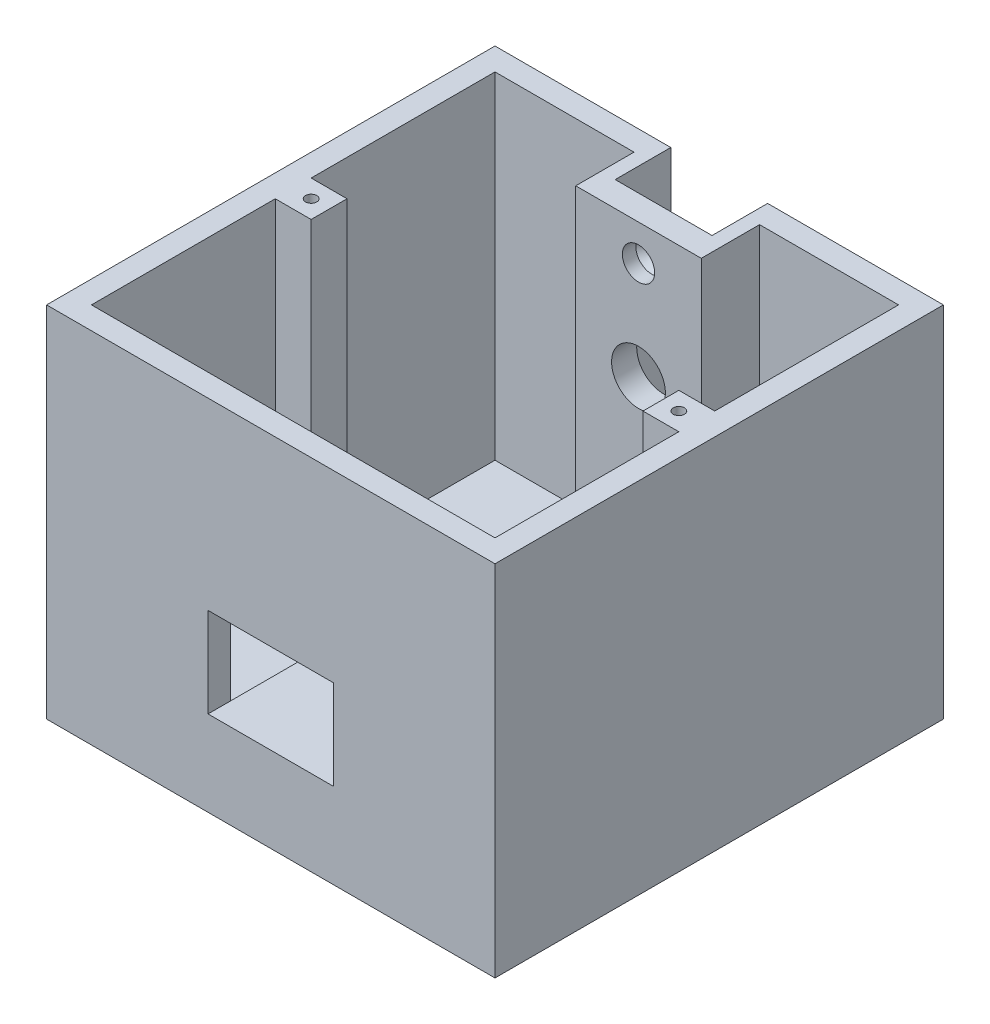
from build123d import *

# Parameters (mm, degrees)
SKETCH1_W                                      = 50
SKETCH1_H                                      = 50
BOSS_EXTRUDE1_DEPTH                            = 40
SHELL1_T                                       = -2.5
SKETCH2_W                                      = 14
SKETCH2_H                                      = 45
BOSS_EXTRUDE2_DEPTH                            = 7
SKETCH4_W                                      = 10.8
SKETCH4_H                                      = 30.2
CUT_EXTRUDE1_DEPTH                             = 6.2
CSK_SLOT_FOR_M1_6_COUNTERSUNK_FLAT_H_2_COUNT   = 2
CSK_SLOT_FOR_M1_6_COUNTERSUNK_FLAT_H_2_PITCH   = 22
CUT_EXTRUDE4_REACH                             = 48.693
SKETCH11_W                                     = 14
SKETCH11_H                                     = 12
SKETCH19_W                                     = 14
SKETCH19_H                                     = 30.5
BOSS_EXTRUDE5_DEPTH                            = 6.5
SKETCH20_W                                     = 10.8
SKETCH20_H                                     = 30.2
CUT_EXTRUDE6_DEPTH                             = 6.2
CSK_SLOT_FOR_M1_6_COUNTERSUNK_FLAT_H_3_A_COUNT = 2
CSK_SLOT_FOR_M1_6_COUNTERSUNK_FLAT_H_3_A_PITCH = 22
SKETCH30_W                                     = 4
SKETCH30_H                                     = 4
BOSS_EXTRUDE6_DEPTH                            = 37.5
CUT_EXTRUDE8_REACH                             = 66.37
SKETCH33_R                                     = 3
SKETCH35_W                                     = 14
SKETCH35_H                                     = 10
CUT_EXTRUDE10_DEPTH                            = 10


with BuildPart() as part:
    # Sketch1 → Boss-Extrude1 (new body)
    with BuildSketch(Plane(origin=(0, 0, 0), x_dir=(1, 0, 0), z_dir=(0, 1, 0))):
        Rectangle(SKETCH1_W, SKETCH1_H)
    extrude(amount=BOSS_EXTRUDE1_DEPTH)

    # Shell1
    shell1_openings = [part.faces().sort_by_distance(p)[0] for p in [
        (0, 40, 0),
    ]]
    offset(amount=SHELL1_T, openings=shell1_openings, kind=Kind.INTERSECTION)

    # Sketch2 → Boss-Extrude2 (add)
    with BuildSketch(Plane(origin=(0, 2.5, 0), x_dir=(1, 0, 0), z_dir=(0, 1, 0))):
        Rectangle(SKETCH2_W, SKETCH2_H)
    extrude(amount=BOSS_EXTRUDE2_DEPTH)

    # Sketch4 → Cut-Extrude1 (cut)
    with BuildSketch(Plane.XZ):
        Rectangle(SKETCH4_W, SKETCH4_H)
    extrude(amount=-CUT_EXTRUDE1_DEPTH, mode=Mode.SUBTRACT)

    # Sketch7 → CSK SLOT for M1.6 Countersunk Flat Head (revolve, cut)
    with BuildSketch(Plane(origin=(0, 9.5, -11), x_dir=(0, 0, 1), z_dir=(1, 0, 0))):
        Polygon((0, 0), (0, 9.5), (0.9, 9.5), (0.9, 2.9), (1.8, 2), (1.8, 0), align=None)
    csk_slot_for_m1_6_countersunk_flat_head = revolve(axis=Axis((0, 15.85, -11), (0, -1, 0)), mode=Mode.SUBTRACT)

    # CSK SLOT for M1.6 Countersunk Flat H 2: CSK SLOT for M1.6 Countersunk Flat Head ×2
    with Locations(*[(0, 0, i * CSK_SLOT_FOR_M1_6_COUNTERSUNK_FLAT_H_2_PITCH) for i in range(1, CSK_SLOT_FOR_M1_6_COUNTERSUNK_FLAT_H_2_COUNT)]):
        add(csk_slot_for_m1_6_countersunk_flat_head, mode=Mode.SUBTRACT)

    # Cut-Extrude4: up to this face of the body (flat: up to its plane)
    cut_extrude4_end = Plane(part.part.faces().sort_by_distance((-14.75, 2.5, 0))[0])
    # Sketch11 → Cut-Extrude4 (cut, up to the picked face)
    with BuildSketch(Plane(origin=(0, 9.5, 0), x_dir=(1, 0, 0), z_dir=(0, 1, 0)), mode=Mode.PRIVATE) as cut_extrude4_sk1:
        Rectangle(SKETCH11_W, SKETCH11_H)
    cut_extrude4_tool1 = split(extrude(cut_extrude4_sk1.sketch, amount=-CUT_EXTRUDE4_REACH, mode=Mode.PRIVATE), bisect_by=cut_extrude4_end, keep=Keep.BOTH, mode=Mode.PRIVATE)
    add(cut_extrude4_tool1.solids().sort_by(Axis((0, 9.5, 0), (0, -1, 0)))[0], mode=Mode.SUBTRACT)

    # Sketch19 → Boss-Extrude5 (add)
    with BuildSketch(Plane.XY.offset(-22.5)):
        with Locations((0, 24.75)):
            Rectangle(SKETCH19_W, SKETCH19_H)
    extrude(amount=BOSS_EXTRUDE5_DEPTH)

    # Sketch20 → Cut-Extrude6 (cut)
    with BuildSketch(Plane(origin=(0, 0, -25), x_dir=(-1, 0, 0), z_dir=(0, 0, -1))):
        with Locations((0, 25)):
            Rectangle(SKETCH20_W, SKETCH20_H)
    extrude(amount=-CUT_EXTRUDE6_DEPTH, mode=Mode.SUBTRACT)

    # Sketch27 → CSK SLOT for M1.6 Countersunk Flat H 3 (revolve, cut)
    with BuildSketch(Plane(origin=(0, 36, -16), x_dir=(0, -1, 0), z_dir=(1, 0, 0))):
        Polygon((0, 0), (0, 40.540774557), (0.9, 40), (0.9, 2.4), (1.8, 1.5), (1.8, 0), align=None)
    csk_slot_for_m1_6_countersunk_flat_h_3 = revolve(axis=Axis((0, 36, -9.65), (0, 0, -1)), mode=Mode.SUBTRACT)

    # CSK SLOT for M1.6 Countersunk Flat H 3 a: CSK SLOT for M1.6 Countersunk Flat H 3 ×2
    with Locations(*[(0, -i * CSK_SLOT_FOR_M1_6_COUNTERSUNK_FLAT_H_3_A_PITCH, 0) for i in range(1, CSK_SLOT_FOR_M1_6_COUNTERSUNK_FLAT_H_3_A_COUNT)]):
        add(csk_slot_for_m1_6_countersunk_flat_h_3, mode=Mode.SUBTRACT)

    # Sketch30 → Boss-Extrude6 (add)
    with BuildSketch(Plane(origin=(0, 2.5, 0), x_dir=(1, 0, 0), z_dir=(0, 1, 0))):
        with Locations((-20.5, 0)):
            Rectangle(SKETCH30_W, SKETCH30_H)
    boss_extrude6 = extrude(amount=BOSS_EXTRUDE6_DEPTH)

    # Sketch32 → M1.6 Tapped Hole2 (revolve, cut)
    with BuildSketch(Plane(origin=(-20.5, 40, 0), x_dir=(0, 0, 1), z_dir=(1, 0, 0))):
        Polygon((0, 0), (0, 5.375537887), (0.625, 5), (0.625, 0), align=None)
    m1_6_tapped_hole2 = revolve(axis=Axis((-20.5, 46.35, 0), (0, -1, 0)), mode=Mode.SUBTRACT)

    # Mirror3: Boss-Extrude6, M1.6 Tapped Hole2 across plane
    add(boss_extrude6.mirror(Plane(origin=(0, 0, 0), x_dir=(0, 0, 1), z_dir=(1, 0, 0))))
    add(m1_6_tapped_hole2.mirror(Plane(origin=(0, 0, 0), x_dir=(0, 0, 1), z_dir=(1, 0, 0))), mode=Mode.SUBTRACT)

    # Sketch33 → Cut-Extrude8 (cut, up to next)
    with BuildSketch(Plane(origin=(0, 0, -18.8), x_dir=(-1, 0, 0), z_dir=(0, 0, -1)), mode=Mode.PRIVATE) as cut_extrude8_sk1:
        with Locations((0, 25)):
            Circle(SKETCH33_R)
    cut_extrude8_tool1 = extrude(cut_extrude8_sk1.sketch, amount=-CUT_EXTRUDE8_REACH, mode=Mode.PRIVATE) & part.part
    add(cut_extrude8_tool1.solids().sort_by_distance((0, 25, -18.8))[0], mode=Mode.SUBTRACT)

    # Sketch35 → Cut-Extrude10 (cut)
    with BuildSketch(Plane(origin=(0, 0, 22.5), x_dir=(-1, 0, 0), z_dir=(0, 0, -1))):
        with Locations((0, 14.5)):
            Rectangle(SKETCH35_W, SKETCH35_H)
    extrude(amount=-CUT_EXTRUDE10_DEPTH, mode=Mode.SUBTRACT)


solid = part.part
